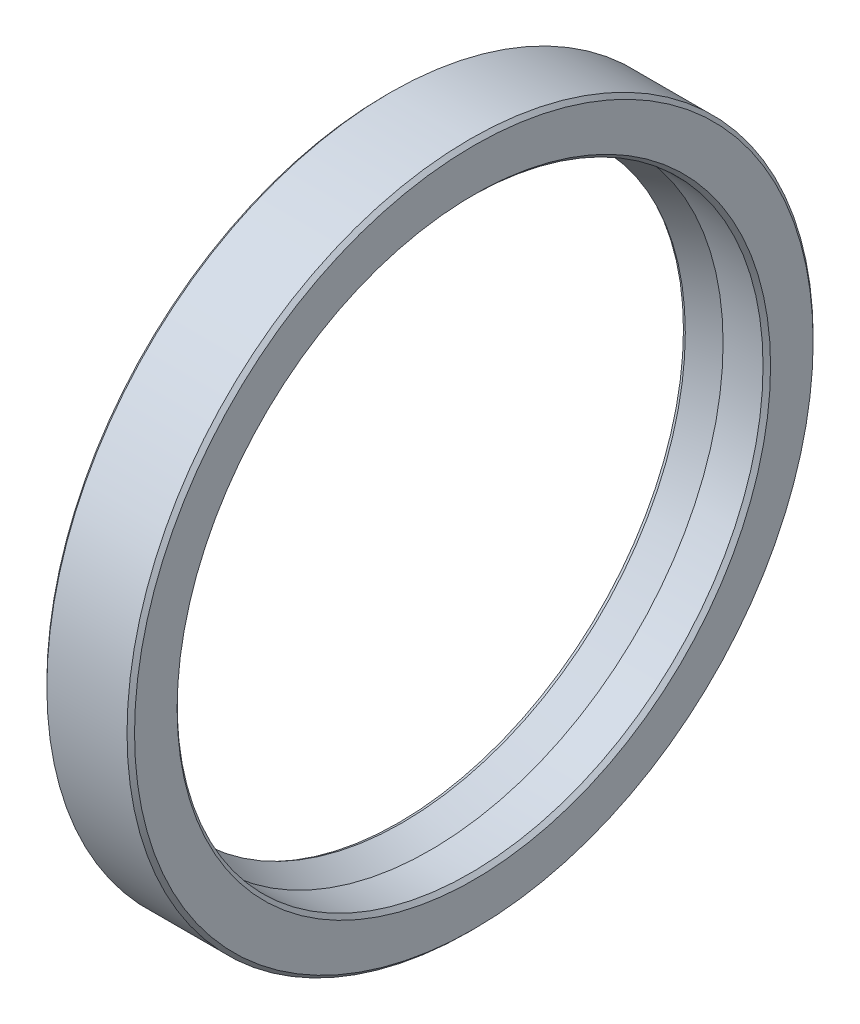
from build123d import *


with BuildPart() as part:
    # Sketch1 → Revolve1 (revolve)
    with BuildSketch(Plane.XY, mode=Mode.PRIVATE) as revolve1_sk:
        with BuildLine():
            Line((0.3, 0), (6.7, 0))
            Line((6.7, 0), (7, -0.3))
            Line((7, -0.3), (7, -3.7))
            Line((7, -3.7), (6.7, -4))
            Line((6.7, -4), (3.51, -4))
            Line((3.51, -4), (1.282751221, -4.789741599))
            Line((1.282751221, -4.789741599), (1, -4.655018958))
            Line((1, -4.655018958), (1, -4.33926311))
            ThreePointArc((1, -4.33926311), (1.086253422, -4.058525208), (1.315255077, -3.874645726))
            Line((1.315255077, -3.874645726), (4.277117384, -2.696926076))
            ThreePointArc((4.277117384, -2.696926076), (4.740634261, -1.881843783), (4.04651406, -1.251443761))
            Line((4.04651406, -1.251443761), (0, -1))
            Line((0, -1), (0, -0.3))
            Line((0, -0.3), (0.3, 0))
        make_face()
    revolve(revolve1_sk.sketch.rotate(Axis((1.282751221, -27.389741599, 0), (-1, 0, 0)), 90), axis=Axis((1.282751221, -27.389741599, 0), (-1, 0, 0)))


solid = part.part
